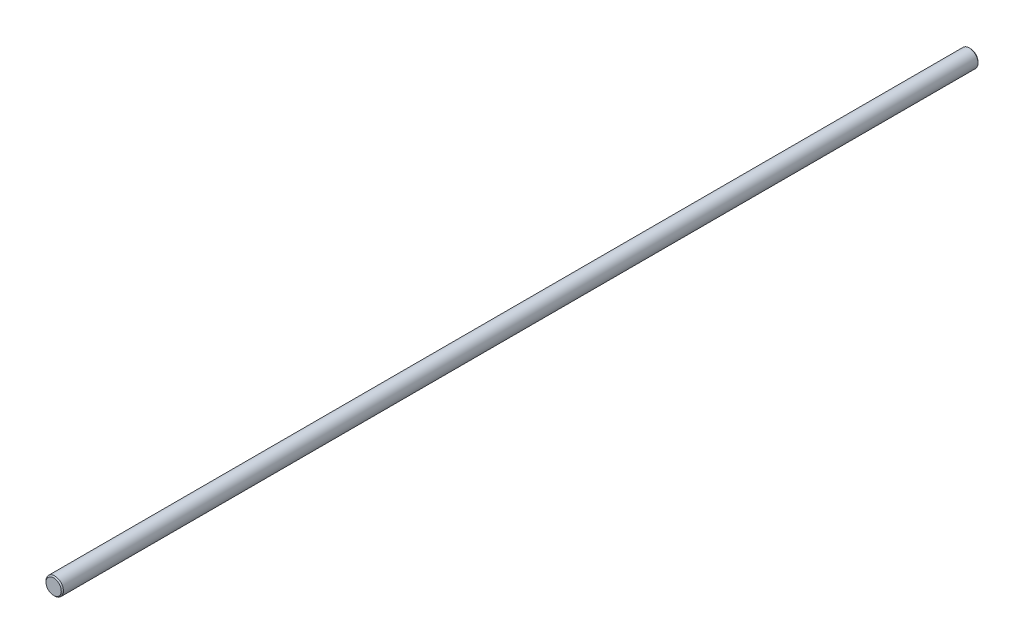
from build123d import *

# Parameters (mm, degrees)
SZKIC1_R                    = 4
DODANIE_WYCI_GNI_CIE1_DEPTH = 420
SFAZOWANIE1_SIZE            = 0.5


with BuildPart() as part:
    # Szkic1 → Dodanie-wyciągnięcie1 (new body)
    with BuildSketch(Plane.XY):
        Circle(SZKIC1_R)
    extrude(amount=DODANIE_WYCI_GNI_CIE1_DEPTH)

    # Sfazowanie1
    sfazowanie1_edges = [part.edges().sort_by_distance(p)[0] for p in [
        (-4, 0, 0),
        (-4, 0, 420),
    ]]
    chamfer(sfazowanie1_edges, length=SFAZOWANIE1_SIZE)


solid = part.part
